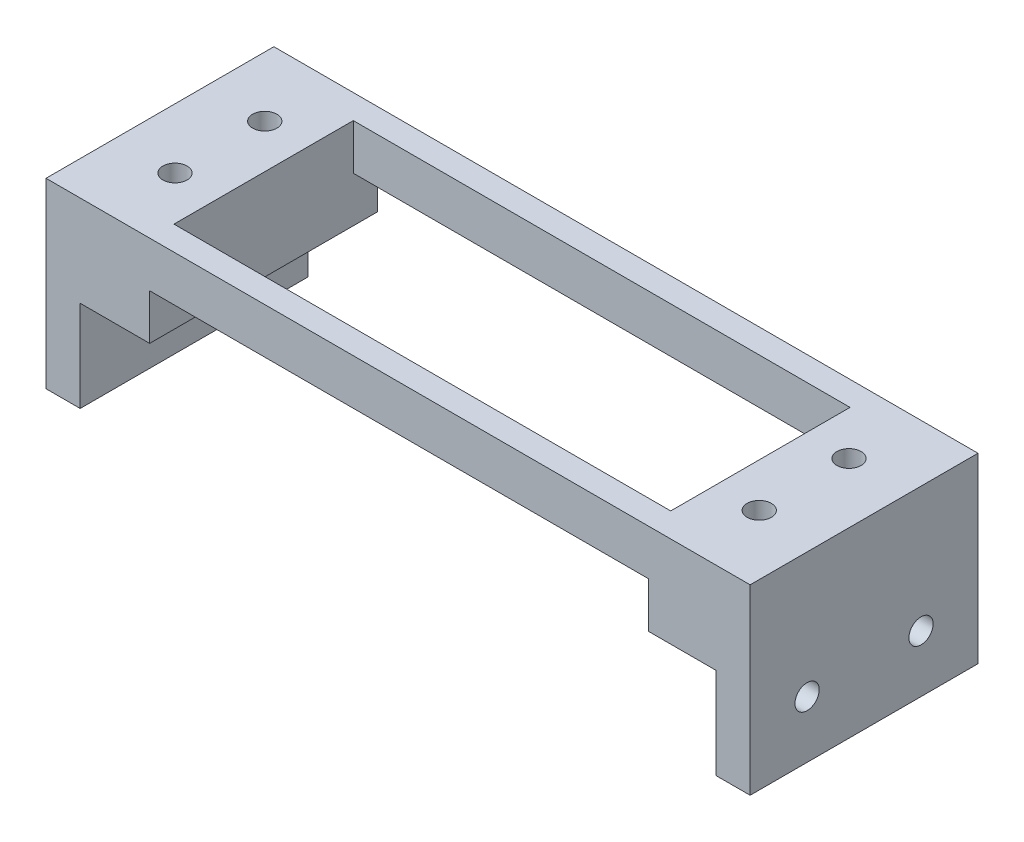
from build123d import *

# Parameters (mm, degrees)
SKETCH1_W                          = 70.866
SKETCH1_H                          = 25.4
SKETCH1_W_2                        = 55.372
SKETCH1_H_2                        = 19.9898
BOSS_EXTRUDE1_DEPTH                = 5.08
SKETCH7_W                          = 7.747
SKETCH7_H                          = 25.4
SKETCH7_W_2                        = 7.523824479
BOSS_EXTRUDE2_DEPTH                = 5.08
BOSS_EXTRUDE3_DEPTH                = 25.4
TAP_DRILL_FOR_6_32_TAP1_D          = 2.7051
TAP_DRILL_FOR_6_32_TAP1_DEPTH      = 10.16
TAP_DRILL_FOR_6_32_TAP1_TIP        = 0.81269403
TAP_DRILL_FOR_6_32_TAP2_AT_2_COUNT = 2
TAP_DRILL_FOR_6_32_TAP2_AT_2_PITCH = 12.7


with BuildPart() as part:
    # Sketch1 → Boss-Extrude1 (new body)
    with BuildSketch(Plane(origin=(0, 0, 0), x_dir=(1, 0, 0), z_dir=(0, 1, 0))):
        Rectangle(SKETCH1_W, SKETCH1_H)
        Rectangle(SKETCH1_W_2, SKETCH1_H_2, mode=Mode.SUBTRACT)
    extrude(amount=BOSS_EXTRUDE1_DEPTH)

    # Sketch7 → Boss-Extrude2 (add)
    with BuildSketch(Plane.XZ):
        with Locations((-31.5595, 0)):
            Rectangle(SKETCH7_W, SKETCH7_H)
        with Locations((31.671087761, 0)):
            Rectangle(SKETCH7_W_2, SKETCH7_H)
    extrude(amount=BOSS_EXTRUDE2_DEPTH)

    # Sketch8 → Boss-Extrude3 (add)
    with BuildSketch(Plane.XY.offset(12.7)):
        Polygon((35.433, 5.08), (35.433, -15.24), (39.243, -15.24), (39.243, -5.08), (39.243, 5.08), align=None)
    boss_extrude3 = extrude(amount=-BOSS_EXTRUDE3_DEPTH)

    # Mirror1: Boss-Extrude3 across plane
    add(boss_extrude3.mirror(Plane(origin=(0, 0, 0), x_dir=(0, 0, 1), z_dir=(1, 0, 0))))

    # Tap Drill for #6-32 Tap1
    with Locations(Plane(origin=(0, 5.08, 0), x_dir=(1, 0, 0), z_dir=(0, 1, 0))):
        with Locations((-32.5628, 5.0038), (-32.5628, -5.0038), (32.5628, 5.0038), (32.5628, -5.0038)):
            Hole(TAP_DRILL_FOR_6_32_TAP1_D / 2, depth=TAP_DRILL_FOR_6_32_TAP1_DEPTH)
            with Locations((0, 0, -(TAP_DRILL_FOR_6_32_TAP1_DEPTH + TAP_DRILL_FOR_6_32_TAP1_TIP / 2))):  # 118° drill point
                Cone(0, TAP_DRILL_FOR_6_32_TAP1_D / 2, TAP_DRILL_FOR_6_32_TAP1_TIP, mode=Mode.SUBTRACT)

    # Sketch10 → Tap Drill for #6-32 Tap2 (revolve, cut)
    with BuildSketch(Plane(origin=(-39.243, -8.89, -6.35), x_dir=(0, 0, 1), z_dir=(0, 1, 0))):
        Polygon((0, 0), (0, 10.97269403), (1.35255, 10.16), (1.35255, 0), align=None)
    tap_drill_for_6_32_tap2 = revolve(axis=Axis((-45.593, -8.89, -6.35), (1, 0, 0)), mode=Mode.SUBTRACT)

    # Tap Drill for #6-32 Tap2 at 2: Tap Drill for #6-32 Tap2 ×2
    with Locations(*[(0, 0, i * TAP_DRILL_FOR_6_32_TAP2_AT_2_PITCH) for i in range(1, TAP_DRILL_FOR_6_32_TAP2_AT_2_COUNT)]):
        add(tap_drill_for_6_32_tap2, mode=Mode.SUBTRACT)

    # Mirror2: Tap Drill for #6-32 Tap2 across plane
    add(tap_drill_for_6_32_tap2.mirror(Plane(origin=(0, 0, 0), x_dir=(0, 0, 1), z_dir=(1, 0, 0))), mode=Mode.SUBTRACT)

    # Mirror2 copy 1 sketch → Mirror2 copy 1 (revolve, cut)
    with BuildSketch(Plane(origin=(39.243, -8.89, 6.35), x_dir=(0, 0, 1), z_dir=(0, 1, 0))):
        Polygon((0, 0), (0, -10.97269403), (1.35255, -10.16), (1.35255, 0), align=None)
    revolve(axis=Axis((45.593, -8.89, 6.35), (1, 0, 0)), mode=Mode.SUBTRACT)


solid = part.part
